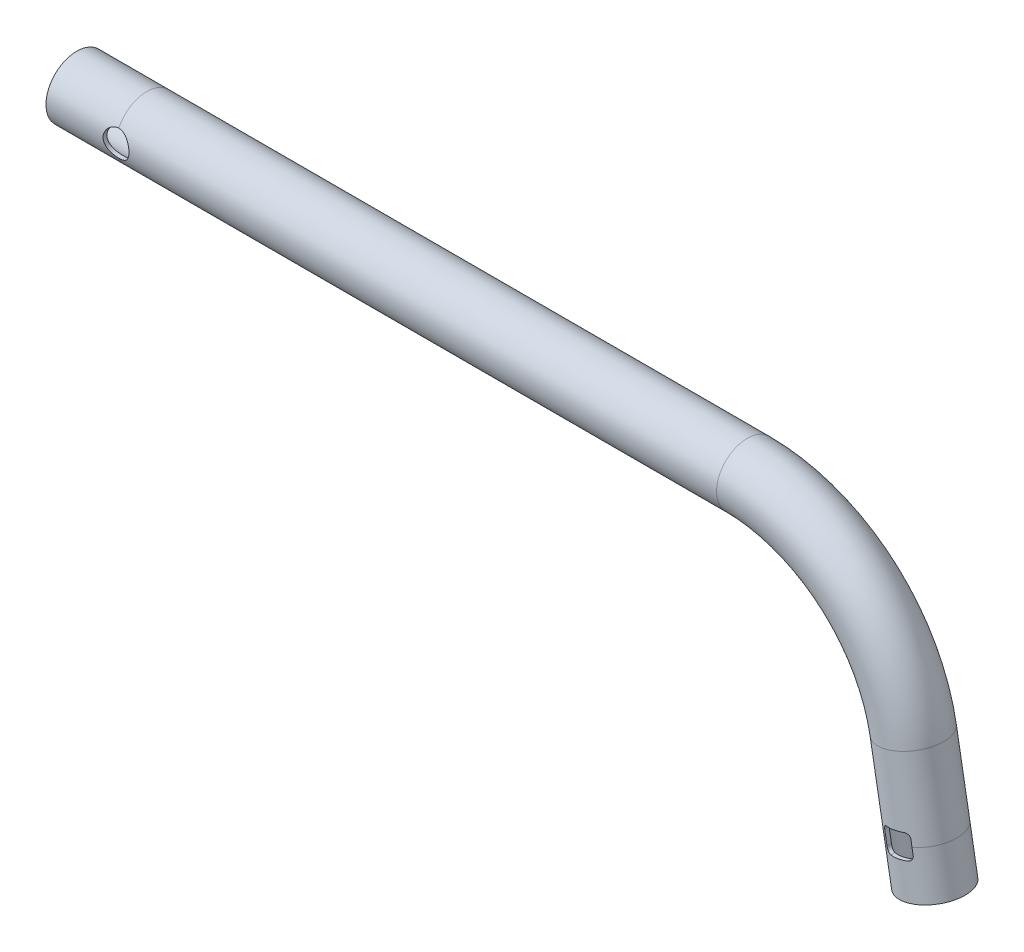
from build123d import *

# Parameters (mm, degrees)
SKETCH2_R                      = 9.5
SKETCH2_R_2                    = 8.3
CUT_EXTRUDE1_REACH             = 267.847
CUT_EXTRUDE1_DIRECTION_2_REACH = 267.847
CUT_EXTRUDE2_REACH             = 267.847
CUT_EXTRUDE2_END_RADIUS        = 9.5
SKETCH4_R                      = 4


with BuildPart() as part:
    # Sweep1: sweep along a path in Sketch1
    with BuildLine(Plane.XY) as sweep1_path:
        Line((-21.6, 0), (0, 0))
        Line((0, 0), (185.373442264, 0))
        ThreePointArc((185.373442264, 0), (218.798397967, -12.165688958), (236.58344542, -42.970294761))
        Line((236.58344542, -42.970294761), (240.75, -66.6))
        Line((240.75, -66.6), (243.236210428, -80.7))
    # Sketch2 → Sweep1 (sweep)
    with BuildSketch(Plane.ZY.offset(21.6)):
        Circle(SKETCH2_R)
        Circle(SKETCH2_R_2, mode=Mode.SUBTRACT)
    sweep(path=sweep1_path.line)

    # Sketch3 → Cut-Extrude1 (cut, up to next)
    with BuildSketch(Plane.XY, mode=Mode.PRIVATE) as cut_extrude1_sk1:
        with BuildLine():
            Line((245.149518391, -67.939949686), (244.425905183, -63.836135257))
            ThreePointArc((244.425905183, -63.836135257), (243.809058208, -62.867879457), (242.688221287, -62.619395894))
            Line((242.688221287, -62.619395894), (237.567220972, -63.522366418))
            ThreePointArc((237.567220972, -63.522366418), (236.598965172, -64.139213393), (236.350481609, -65.260050314))
            Line((236.350481609, -65.260050314), (237.074094817, -69.363864743))
            ThreePointArc((237.074094817, -69.363864743), (237.690941792, -70.332120543), (238.811778713, -70.580604106))
            Line((238.811778713, -70.580604106), (243.932779028, -69.677633582))
            ThreePointArc((243.932779028, -69.677633582), (244.901034828, -69.060786607), (245.149518391, -67.939949686))
        make_face()
    cut_extrude1_tool1 = extrude(cut_extrude1_sk1.sketch, amount=-CUT_EXTRUDE1_REACH, mode=Mode.PRIVATE) & part.part
    add(cut_extrude1_tool1.solids().sort_by_distance((240.75, -66.6, 0))[0], mode=Mode.SUBTRACT)

    # Sketch3 → Cut-Extrude1 direction 2 (cut, up to next)
    with BuildSketch(Plane.XY, mode=Mode.PRIVATE) as cut_extrude1_direction_2_sk1:
        with BuildLine():
            Line((245.149518391, -67.939949686), (244.425905183, -63.836135257))
            ThreePointArc((244.425905183, -63.836135257), (243.809058208, -62.867879457), (242.688221287, -62.619395894))
            Line((242.688221287, -62.619395894), (237.567220972, -63.522366418))
            ThreePointArc((237.567220972, -63.522366418), (236.598965172, -64.139213393), (236.350481609, -65.260050314))
            Line((236.350481609, -65.260050314), (237.074094817, -69.363864743))
            ThreePointArc((237.074094817, -69.363864743), (237.690941792, -70.332120543), (238.811778713, -70.580604106))
            Line((238.811778713, -70.580604106), (243.932779028, -69.677633582))
            ThreePointArc((243.932779028, -69.677633582), (244.901034828, -69.060786607), (245.149518391, -67.939949686))
        make_face()
    cut_extrude1_direction_2_tool1 = extrude(cut_extrude1_direction_2_sk1.sketch, amount=CUT_EXTRUDE1_DIRECTION_2_REACH, mode=Mode.PRIVATE) & part.part
    add(cut_extrude1_direction_2_tool1.solids().sort_by_distance((240.75, -66.6, 0))[0], mode=Mode.SUBTRACT)

    # Cut-Extrude2: up to this cylinder (the profile starts inside it)
    cut_extrude2_end = Plane(origin=(0, 0, 0), z_dir=(-1, 0, 0)) * Cylinder(CUT_EXTRUDE2_END_RADIUS, 555.694, mode=Mode.PRIVATE)
    # Sketch4 → Cut-Extrude2 (cut, up to the surface)
    with BuildSketch(Plane.XY, mode=Mode.PRIVATE) as cut_extrude2_sk1:
        with Locations(Location((0, 0, 0), (0, 0, 90))):
            Circle(SKETCH4_R)
    cut_extrude2_tool1 = extrude(cut_extrude2_sk1.sketch, amount=CUT_EXTRUDE2_REACH, mode=Mode.PRIVATE) & cut_extrude2_end
    add(cut_extrude2_tool1.solids().sort_by_distance((0, 0, 0))[0], mode=Mode.SUBTRACT)


solid = part.part
